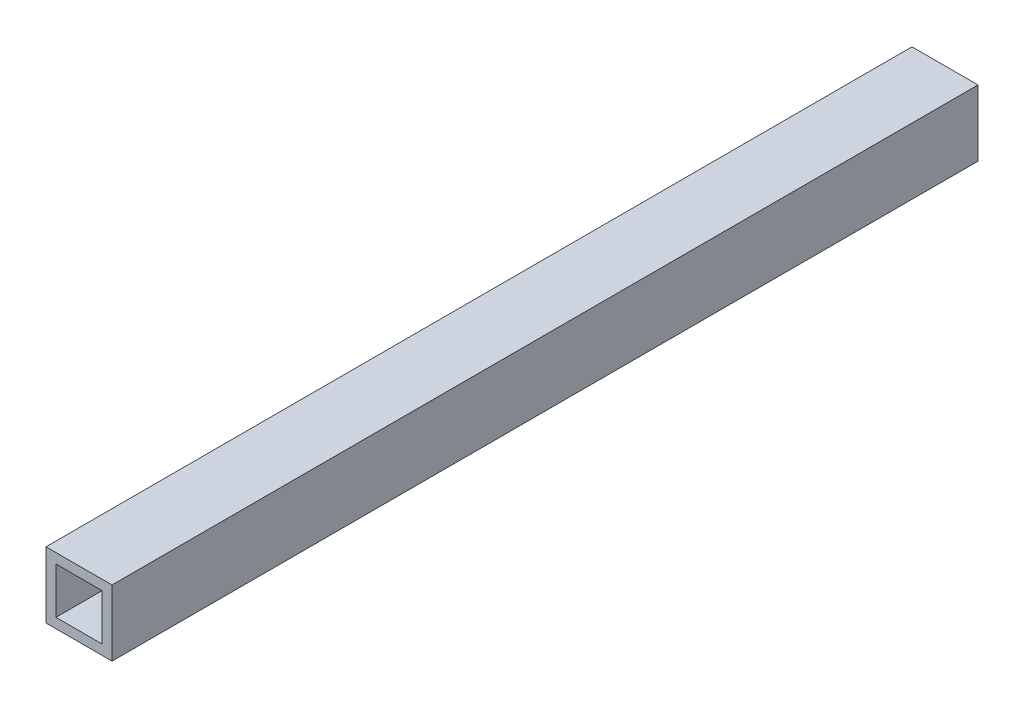
from build123d import *

# Parameters (mm, degrees)
SKETCH1_W           = 10
SKETCH1_H           = 10
SKETCH1_W_2         = 7
SKETCH1_H_2         = 7
BOSS_EXTRUDE1_DEPTH = 131.16


with BuildPart() as part:
    # Sketch1 → Boss-Extrude1 (new body)
    with BuildSketch(Plane.XY):
        Rectangle(SKETCH1_W, SKETCH1_H)
        Rectangle(SKETCH1_W_2, SKETCH1_H_2, mode=Mode.SUBTRACT)
    extrude(amount=BOSS_EXTRUDE1_DEPTH)


solid = part.part
